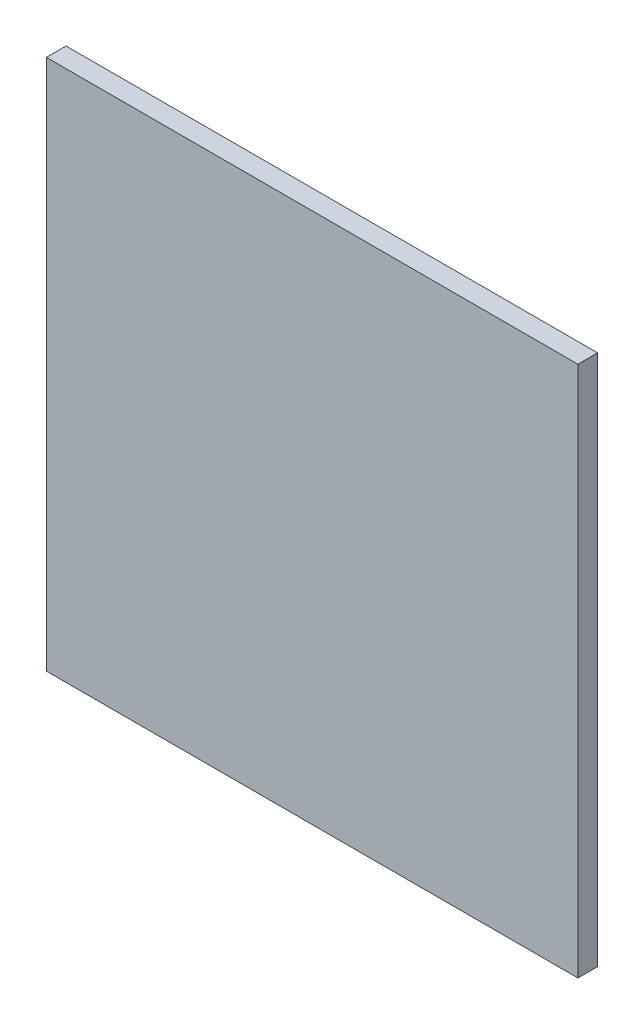
from build123d import *

# Parameters (mm, degrees)
SKETCH1_W           = 342.9
SKETCH1_H           = 342.9
BOSS_EXTRUDE1_DEPTH = 12.7


with BuildPart() as part:
    # Sketch1 → Boss-Extrude1 (new body)
    with BuildSketch(Plane.XY):
        Rectangle(SKETCH1_W, SKETCH1_H)
    extrude(amount=BOSS_EXTRUDE1_DEPTH)


solid = part.part
